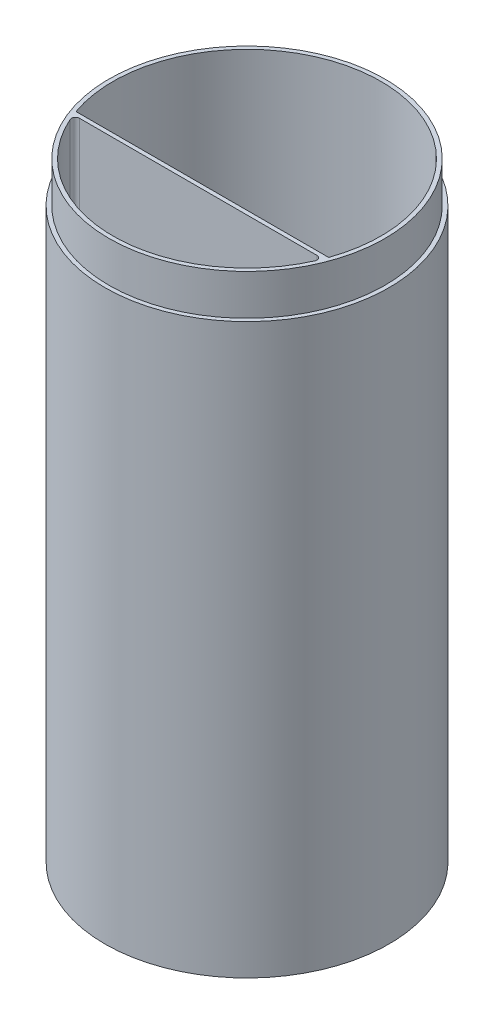
from build123d import *

# Parameters (mm, degrees)
SKETCH1_R           = 35
BOSS_EXTRUDE1_DEPTH = 150
FILLET1_R           = 1
CUT_EXTRUDE1_START  = -10
SKETCH3_R           = 35
SKETCH3_R_2         = 34
CUT_EXTRUDE1_DEPTH  = 10
BOSS_EXTRUDE2_START = -5
SKETCH4_R           = 2.25
BOSS_EXTRUDE2_DEPTH = 6
BOSS_EXTRUDE3_DEPTH = 64


with BuildPart() as part:
    # Sketch1 → Boss-Extrude1 (new body)
    with BuildSketch(Plane(origin=(0, 0, 0), x_dir=(1, 0, 0), z_dir=(0, 1, 0))):
        with Locations(Location((0, 0, 0), (0, 0, 270))):
            Circle(SKETCH1_R)
        with BuildLine():
            Line((-31.448370387, -10), (31.448370387, -10))
            ThreePointArc((31.448370387, -10), (0, 33), (-31.448370387, -10))
        make_face(mode=Mode.SUBTRACT)
        with BuildLine():
            Line((-30.740852298, -12), (30.740852298, -12))
            ThreePointArc((30.740852298, -12), (0, -33), (-30.740852298, -12))
        make_face(mode=Mode.SUBTRACT)
    extrude(amount=BOSS_EXTRUDE1_DEPTH)

    # Fillet1
    fillet1_edges = [part.edges().sort_by_distance(p)[0] for p in [
        (-30.740852298, 75, 12),
        (30.740852298, 75, 12),
        (31.448370387, 75, 10),
        (-31.448370387, 75, 10),
    ]]
    fillet(fillet1_edges, radius=FILLET1_R)

    # Sketch3 → Cut-Extrude1 (cut)
    # profile 1 of 2: a face of its own
    with BuildSketch(Plane(origin=(0, 150, 0), x_dir=(1, 0, 0), z_dir=(0, 1, 0)).offset(CUT_EXTRUDE1_START)):
        with Locations(Location((0, 0, 0), (0, 0, 270))):
            Circle(SKETCH3_R)
        with Locations(Location((0, 0, 0), (0, 0, 270))):
            Circle(SKETCH3_R_2, mode=Mode.SUBTRACT)
    # profile 2 of 2: a face of its own
    with BuildSketch(Plane(origin=(0, 150, 0), x_dir=(1, 0, 0), z_dir=(0, 1, 0)).offset(CUT_EXTRUDE1_START)):
        with BuildLine():
            Line((30.708305066, -10), (-30.708305066, -10))
            ThreePointArc((-30.708305066, -10), (-31.307784006, -9.80039053), (-31.667939599, -9.28125))
            ThreePointArc((-31.667939599, -9.28125), (-31.402080367, -10.144424508), (-31.112698372, -11))
            Line((-31.112698372, -11), (31.112698372, -11))
            ThreePointArc((31.112698372, -11), (31.402080367, -10.144424508), (31.667939599, -9.28125))
            ThreePointArc((31.667939599, -9.28125), (31.307784006, -9.80039053), (30.708305066, -10))
        make_face()
    extrude(amount=CUT_EXTRUDE1_DEPTH, mode=Mode.SUBTRACT)

    # Sketch4 → Boss-Extrude2 (add)
    with BuildSketch(Plane.XZ.offset(BOSS_EXTRUDE2_START)):
        with BuildLine():
            Line((-23.25, 10), (23.25, 10))
            Line((23.25, 10), (23.25, 0))
            ThreePointArc((23.25, 0), (19.66205807, -8.66205807), (11, -12.25))
            Line((11, -12.25), (7.5, -10.75))
            Line((7.5, -10.75), (-7.5, -10.75))
            Line((-7.5, -10.75), (-11, -12.25))
            ThreePointArc((-11, -12.25), (-19.66205807, -8.66205807), (-23.25, 0))
            Line((-23.25, 0), (-23.25, 10))
        make_face()
        with Locations(Location((0, -7.5, 0), (0, 0, 270))):
            Circle(SKETCH4_R, mode=Mode.SUBTRACT)
        with Locations(Location((20.5, 7.5, 0), (0, 0, 270))):
            Circle(SKETCH4_R, mode=Mode.SUBTRACT)
        with Locations(Location((-20.5, 7.5, 0), (0, 0, 270))):
            Circle(SKETCH4_R, mode=Mode.SUBTRACT)
        with Locations(Location((0, 7.5, 0), (0, 0, 270))):
            Circle(SKETCH4_R, mode=Mode.SUBTRACT)
        with BuildLine():
            Line((-3, 4.643543905), (3, 4.643543905))
            ThreePointArc((3, 4.643543905), (20.25, 0), (3, -4.643543905))
            Line((3, -4.643543905), (-3, -4.643543905))
            ThreePointArc((-3, -4.643543905), (-20.25, 0), (-3, 4.643543905))
        make_face(mode=Mode.SUBTRACT)
    extrude(amount=-BOSS_EXTRUDE2_DEPTH)

    # Sketch5 → Boss-Extrude3 (add)
    with BuildSketch(Plane(origin=(0, 11, 0), x_dir=(1, 0, 0), z_dir=(0, 1, 0))):
        with BuildLine():
            Line((-23.25, 0), (-23.25, -10))
            Line((-23.25, -10), (23.25, -10))
            Line((23.25, -10), (23.25, 0))
            ThreePointArc((23.25, 0), (19.66205807, 8.66205807), (11, 12.25))
            Line((11, 12.25), (7.5, 10.75))
            Line((7.5, 10.75), (-7.5, 10.75))
            Line((-7.5, 10.75), (-11, 12.25))
            ThreePointArc((-11, 12.25), (-19.66205807, 8.66205807), (-23.25, 0))
        make_face()
        with BuildLine():
            Line((3, -4.643543905), (-3, -4.643543905))
            ThreePointArc((-3, -4.643543905), (-20.25, 0), (-3, 4.643543905))
            Line((-3, 4.643543905), (3, 4.643543905))
            ThreePointArc((3, 4.643543905), (20.25, 0), (3, -4.643543905))
        make_face(mode=Mode.SUBTRACT)
    extrude(amount=BOSS_EXTRUDE3_DEPTH)


solid = part.part
